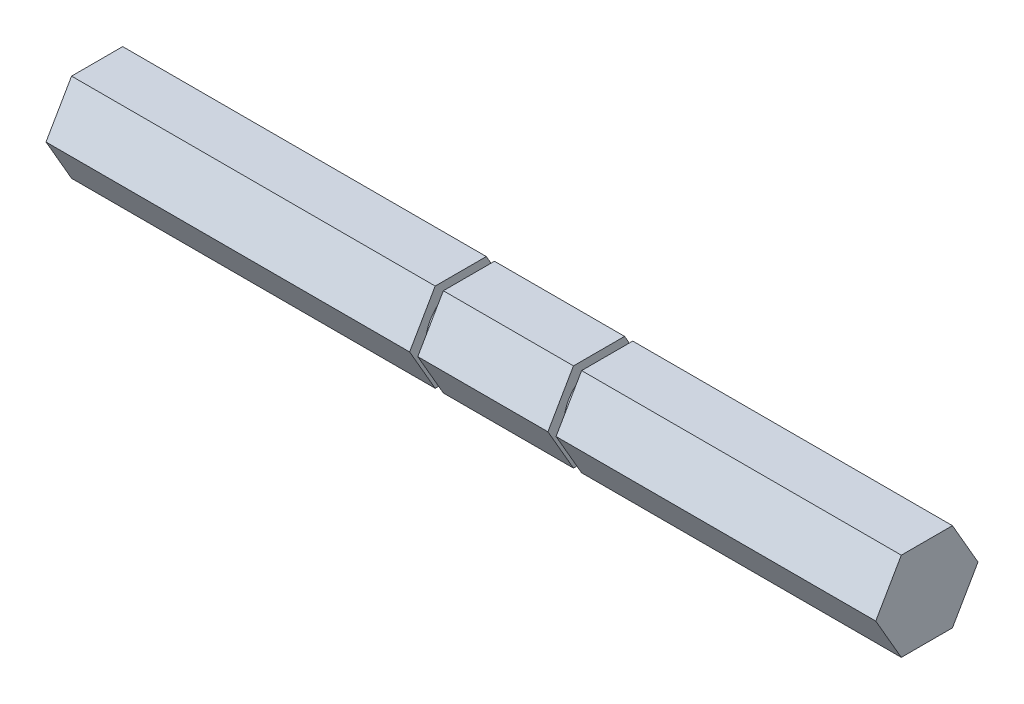
from build123d import *

# Parameters (mm, degrees)
BOSS_EXTRUDE1_DEPTH = 59.5
SKETCH5_W           = 1.1684
SKETCH5_H           = 8.939323218


with BuildPart() as part:
    # Sketch2 → Boss-Extrude1 (new, symmetric)
    with BuildSketch(Plane(origin=(0, 0, 0), x_dir=(0, 0, -1), z_dir=(1, 0, 0))):
        Polygon((7.332348419, 0), (3.666174209, 6.35), (-3.666174209, 6.35), (-7.332348419, 0), (-3.666174209, -6.35), (3.666174209, -6.35), align=None)
    extrude(amount=BOSS_EXTRUDE1_DEPTH, both=True)

    # Sketch5 → Cut-Revolve1 (revolve, cut)
    with BuildSketch(Plane.XY, mode=Mode.PRIVATE) as cut_revolve1_sk:
        with Locations((13.0658, 9.498861609)):
            Rectangle(SKETCH5_W, SKETCH5_H)
        with Locations((-6.7658, 9.498861609)):
            Rectangle(SKETCH5_W, SKETCH5_H)
    revolve(cut_revolve1_sk.sketch.rotate(Axis((0, 0, 0), (1, 0, 0)), 90), axis=Axis((0, 0, 0), (1, 0, 0)), mode=Mode.SUBTRACT)


solid = part.part
